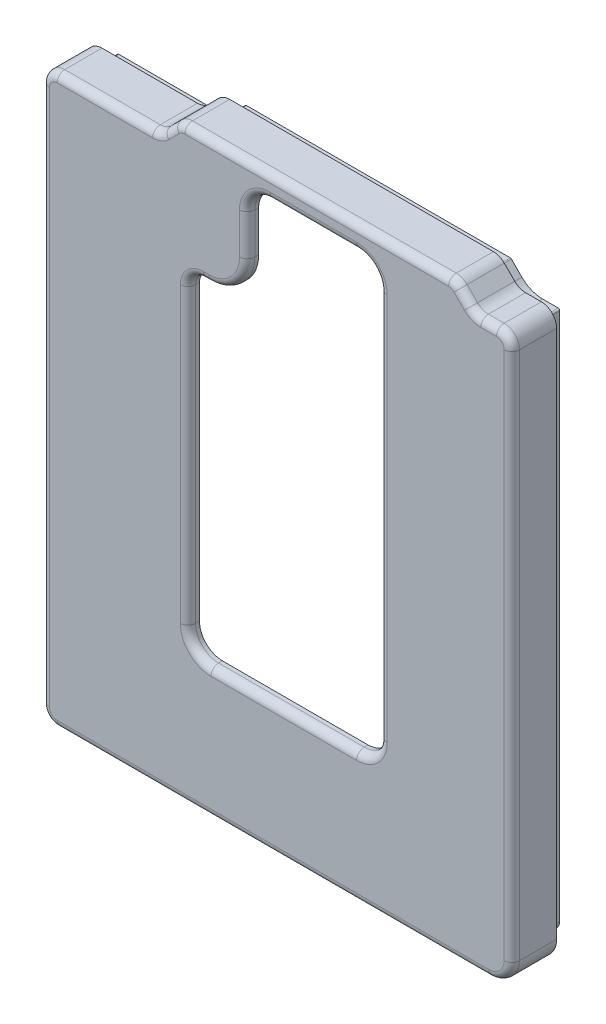
from build123d import *

# Parameters (mm, degrees)
BOSS_EXTRUDE1_DEPTH = 1.5
BOSS_EXTRUDE2_START = 6.55
BOSS_EXTRUDE2_DEPTH = 6.55
SKETCH4_W           = 11.085213563
SKETCH4_H           = 3
SKETCH4_W_2         = 13.3
BOSS_EXTRUDE4_DEPTH = 1
CUT_EXTRUDE1_DEPTH  = 2.2
FILLET1_R           = 1


with BuildPart() as part:
    # Sketch2 → Boss-Extrude1 (new body)
    with BuildSketch(Plane.XY):
        with BuildLine():
            Line((-15.064293146, -76.617402573), (-4.394293146, -76.617402573))
            Line((-4.394293146, -76.617402573), (41.275706854, -76.617402573))
            ThreePointArc((41.275706854, -76.617402573), (43.397027197, -75.738722916), (44.275706854, -73.617402573))
            Line((44.275706854, -73.617402573), (44.275706854, -4.577402573))
            ThreePointArc((44.275706854, -4.577402573), (43.689920416, -3.16318901), (42.275706854, -2.577402573))
            Line((42.275706854, -2.577402573), (40.220988228, -2.577402573))
            ThreePointArc((40.220988228, -2.577402573), (39.455621363, -2.425161638), (38.806774666, -1.991616135))
            Line((38.806774666, -1.991616135), (37.438347541, -0.62318901))
            ThreePointArc((37.438347541, -0.62318901), (36.789500843, -0.189643508), (36.024133979, -0.037402573))
            Line((36.024133979, -0.037402573), (1.601279729, -0.037402573))
            ThreePointArc((1.601279729, -0.037402573), (0.835912864, -0.189643508), (0.187066167, -0.62318901))
            Line((0.187066167, -0.62318901), (-1.181360958, -1.991616135))
            ThreePointArc((-1.181360958, -1.991616135), (-1.830207656, -2.425161638), (-2.59557452, -2.577402573))
            Line((-2.59557452, -2.577402573), (-15.064293146, -2.577402573))
            ThreePointArc((-15.064293146, -2.577402573), (-16.478506709, -3.16318901), (-17.064293146, -4.577402573))
            Line((-17.064293146, -4.577402573), (-17.064293146, -74.617402573))
            ThreePointArc((-17.064293146, -74.617402573), (-16.478506709, -76.031616135), (-15.064293146, -76.617402573))
        make_face()
        with BuildLine():
            Line((5.015493291, -59.617402573), (24.015493291, -59.617402573))
            ThreePointArc((24.015493291, -59.617402573), (26.136813635, -58.738722916), (27.015493291, -56.617402573))
            Line((27.015493291, -56.617402573), (27.015493291, -6.037402573))
            ThreePointArc((27.015493291, -6.037402573), (26.136813635, -3.916082229), (24.015493291, -3.037402573))
            Line((24.015493291, -3.037402573), (12.735677005, -3.037402573))
            ThreePointArc((12.735677005, -3.037402573), (10.614356661, -3.916082229), (9.735677005, -6.037402573))
            Line((9.735677005, -6.037402573), (9.735677005, -11.358022899))
            ThreePointArc((9.735677005, -11.358022899), (8.271210911, -14.893556805), (4.735677005, -16.358022899))
            Line((4.735677005, -16.358022899), (4.015493291, -16.358022899))
            ThreePointArc((4.015493291, -16.358022899), (2.601279729, -16.943809336), (2.015493291, -18.358022899))
            Line((2.015493291, -18.358022899), (2.015493291, -56.617402573))
            ThreePointArc((2.015493291, -56.617402573), (2.894172948, -58.738722916), (5.015493291, -59.617402573))
        make_face(mode=Mode.SUBTRACT)
    extrude(amount=BOSS_EXTRUDE1_DEPTH)

    # Sketch3 → Boss-Extrude2 (add)
    with BuildSketch(Plane(origin=(0, 0, 0), x_dir=(-1, 0, 0), z_dir=(0, 0, -1)).offset(BOSS_EXTRUDE2_START)):
        with BuildLine():
            Line((4.394293146, -75.117402573), (4.394293146, -73.617402573))
            Line((4.394293146, -73.617402573), (14.064293146, -73.617402573))
            Line((14.064293146, -73.617402573), (14.064293146, -5.577402573))
            Line((14.064293146, -5.577402573), (0.524506709, -5.577402573))
            Line((0.524506709, -5.577402573), (-2.015493291, -3.037402573))
            Line((-2.015493291, -3.037402573), (-35.609920416, -3.037402573))
            Line((-35.609920416, -3.037402573), (-38.149920416, -5.577402573))
            Line((-38.149920416, -5.577402573), (-41.275706854, -5.577402573))
            Line((-41.275706854, -5.577402573), (-41.275706854, -73.617402573))
            Line((-41.275706854, -73.617402573), (-38.100706854, -73.617402573))
            Line((-38.100706854, -73.617402573), (-38.100706854, -75.117402573))
            Line((-38.100706854, -75.117402573), (-38.100706854, -76.617402573))
            Line((-38.100706854, -76.617402573), (-41.275706854, -76.617402573))
            ThreePointArc((-41.275706854, -76.617402573), (-43.397027197, -75.738722916), (-44.275706854, -73.617402573))
            Line((-44.275706854, -73.617402573), (-44.275706854, -4.577402573))
            ThreePointArc((-44.275706854, -4.577402573), (-43.689920416, -3.16318901), (-42.275706854, -2.577402573))
            Line((-42.275706854, -2.577402573), (-40.220988228, -2.577402573))
            ThreePointArc((-40.220988228, -2.577402573), (-39.455621363, -2.425161638), (-38.806774666, -1.991616135))
            Line((-38.806774666, -1.991616135), (-37.438347541, -0.62318901))
            ThreePointArc((-37.438347541, -0.62318901), (-36.789500843, -0.189643508), (-36.024133979, -0.037402573))
            Line((-36.024133979, -0.037402573), (-1.601279729, -0.037402573))
            ThreePointArc((-1.601279729, -0.037402573), (-0.835912864, -0.189643508), (-0.187066167, -0.62318901))
            Line((-0.187066167, -0.62318901), (1.181360958, -1.991616135))
            ThreePointArc((1.181360958, -1.991616135), (1.830207656, -2.425161638), (2.59557452, -2.577402573))
            Line((2.59557452, -2.577402573), (15.064293146, -2.577402573))
            ThreePointArc((15.064293146, -2.577402573), (16.478506709, -3.16318901), (17.064293146, -4.577402573))
            Line((17.064293146, -4.577402573), (17.064293146, -74.617402573))
            ThreePointArc((17.064293146, -74.617402573), (16.478506709, -76.031616135), (15.064293146, -76.617402573))
            Line((15.064293146, -76.617402573), (4.394293146, -76.617402573))
            Line((4.394293146, -76.617402573), (4.394293146, -75.117402573))
        make_face()
        Polygon((-8.905706854, -76.617402573), (-8.905706854, -73.617402573), (-27.015493291, -73.617402573), (-27.100706854, -76.617402573), align=None)
    extrude(amount=-BOSS_EXTRUDE2_DEPTH)

    # Sketch4 → Boss-Extrude4 (add)
    with BuildSketch(Plane(origin=(0, 0, 0), x_dir=(-1, 0, 0), z_dir=(0, 0, -1))):
        with Locations((-32.558100073, -75.117402573)):
            Rectangle(SKETCH4_W, SKETCH4_H)
        with Locations((-2.255706854, -75.117402573)):
            Rectangle(SKETCH4_W_2, SKETCH4_H)
    extrude(amount=BOSS_EXTRUDE4_DEPTH)

    # Sketch6 → Cut-Extrude1 (cut)
    with BuildSketch(Plane(origin=(0, 0, -6.55), x_dir=(-1, 0, 0), z_dir=(0, 0, -1))):
        with BuildLine():
            Line((17.064293146, -4.577402573), (17.064293146, -74.617402573))
            ThreePointArc((17.064293146, -74.617402573), (16.478506709, -76.031616135), (15.064293146, -76.617402573))
            Line((15.064293146, -76.617402573), (4.394293146, -76.617402573))
            Line((4.394293146, -76.617402573), (-8.905706854, -76.617402573))
            Line((-8.905706854, -76.617402573), (-27.100706854, -76.617402573))
            Line((-27.100706854, -76.617402573), (-38.100706854, -76.617402573))
            Line((-38.100706854, -76.617402573), (-41.275706854, -76.617402573))
            ThreePointArc((-41.275706854, -76.617402573), (-43.397027197, -75.738722916), (-44.275706854, -73.617402573))
            Line((-44.275706854, -73.617402573), (-44.275706854, -4.577402573))
            ThreePointArc((-44.275706854, -4.577402573), (-43.689920416, -3.16318901), (-42.275706854, -2.577402573))
            Line((-42.275706854, -2.577402573), (-40.220988228, -2.577402573))
            ThreePointArc((-40.220988228, -2.577402573), (-39.455621363, -2.425161638), (-38.806774666, -1.991616135))
            Line((-38.806774666, -1.991616135), (-37.438347541, -0.62318901))
            ThreePointArc((-37.438347541, -0.62318901), (-36.789500843, -0.189643508), (-36.024133979, -0.037402573))
            Line((-36.024133979, -0.037402573), (-1.601279729, -0.037402573))
            ThreePointArc((-1.601279729, -0.037402573), (-0.835912864, -0.189643508), (-0.187066167, -0.62318901))
            Line((-0.187066167, -0.62318901), (1.181360958, -1.991616135))
            ThreePointArc((1.181360958, -1.991616135), (1.830207656, -2.425161638), (2.59557452, -2.577402573))
            Line((2.59557452, -2.577402573), (15.064293146, -2.577402573))
            ThreePointArc((15.064293146, -2.577402573), (16.478506709, -3.16318901), (17.064293146, -4.577402573))
        make_face()
        with BuildLine():
            Line((-38.100706854, -74.817402573), (-41.275706854, -74.817402573))
            ThreePointArc((-41.275706854, -74.817402573), (-42.124234991, -74.46593071), (-42.475706854, -73.617402573))
            Line((-42.475706854, -73.617402573), (-42.475706854, -4.577402573))
            ThreePointArc((-42.475706854, -4.577402573), (-42.41712821, -4.435981216), (-42.275706854, -4.377402573))
            Line((-42.275706854, -4.377402573), (-40.220988228, -4.377402573))
            ThreePointArc((-40.220988228, -4.377402573), (-38.766791185, -4.088144796), (-37.53398246, -3.264408341))
            Line((-37.53398246, -3.264408341), (-36.165555335, -1.895981216))
            ThreePointArc((-36.165555335, -1.895981216), (-36.100670665, -1.852626666), (-36.024133979, -1.837402573))
            Line((-36.024133979, -1.837402573), (-1.601279729, -1.837402573))
            ThreePointArc((-1.601279729, -1.837402573), (-1.524743043, -1.852626666), (-1.459858373, -1.895981216))
            Line((-1.459858373, -1.895981216), (-0.091431248, -3.264408341))
            ThreePointArc((-0.091431248, -3.264408341), (1.141377477, -4.088144796), (2.59557452, -4.377402573))
            Line((2.59557452, -4.377402573), (15.064293146, -4.377402573))
            ThreePointArc((15.064293146, -4.377402573), (15.205714502, -4.435981216), (15.264293146, -4.577402573))
            Line((15.264293146, -4.577402573), (15.264293146, -74.617402573))
            ThreePointArc((15.264293146, -74.617402573), (15.205714502, -74.758823929), (15.064293146, -74.817402573))
            Line((15.064293146, -74.817402573), (4.394293146, -74.817402573))
            Line((4.394293146, -74.817402573), (-38.100706854, -74.817402573))
        make_face(mode=Mode.SUBTRACT)
    extrude(amount=-CUT_EXTRUDE1_DEPTH, mode=Mode.SUBTRACT)

    # Fillet1
    fillet1_edges = [part.edges().sort_by_distance(p)[0] for p in [
        (2.601279729, -16.943809336, 1.5),
        (2.015493291, -37.487712736, 1.5),
        (2.894172948, -58.738722916, 1.5),
        (14.515493291, -59.617402573, 1.5),
        (26.136813635, -58.738722916, 1.5),
        (27.015493291, -31.327402573, 1.5),
        (26.136813635, -3.916082229, 1.5),
        (18.375585148, -3.037402573, 1.5),
        (10.614356661, -3.916082229, 1.5),
        (9.735677005, -8.697712736, 1.5),
        (8.271210911, -14.893556805, 1.5),
        (4.375585148, -16.358022899, 1.5),
        (-17.064293146, -39.597402573, 1.5),
        (-16.478506709, -3.16318901, 1.5),
        (-8.829933833, -2.577402573, 1.5),
        (-1.830207656, -2.425161638, 1.5),
        (-0.497147396, -1.307402573, 1.5),
        (0.835912864, -0.189643508, 1.5),
        (18.812706854, -0.037402573, 1.5),
        (36.789500843, -0.189643508, 1.5),
        (38.122561103, -1.307402573, 1.5),
        (39.455621363, -2.425161638, 1.5),
        (41.248347541, -2.577402573, 1.5),
        (43.689920416, -3.16318901, 1.5),
        (44.275706854, -39.097402573, 1.5),
        (43.397027197, -75.738722916, 1.5),
        (13.105706854, -76.617402573, 1.5),
        (-16.478506709, -76.031616135, 1.5),
    ]]
    fillet(fillet1_edges, radius=FILLET1_R)


solid = part.part
